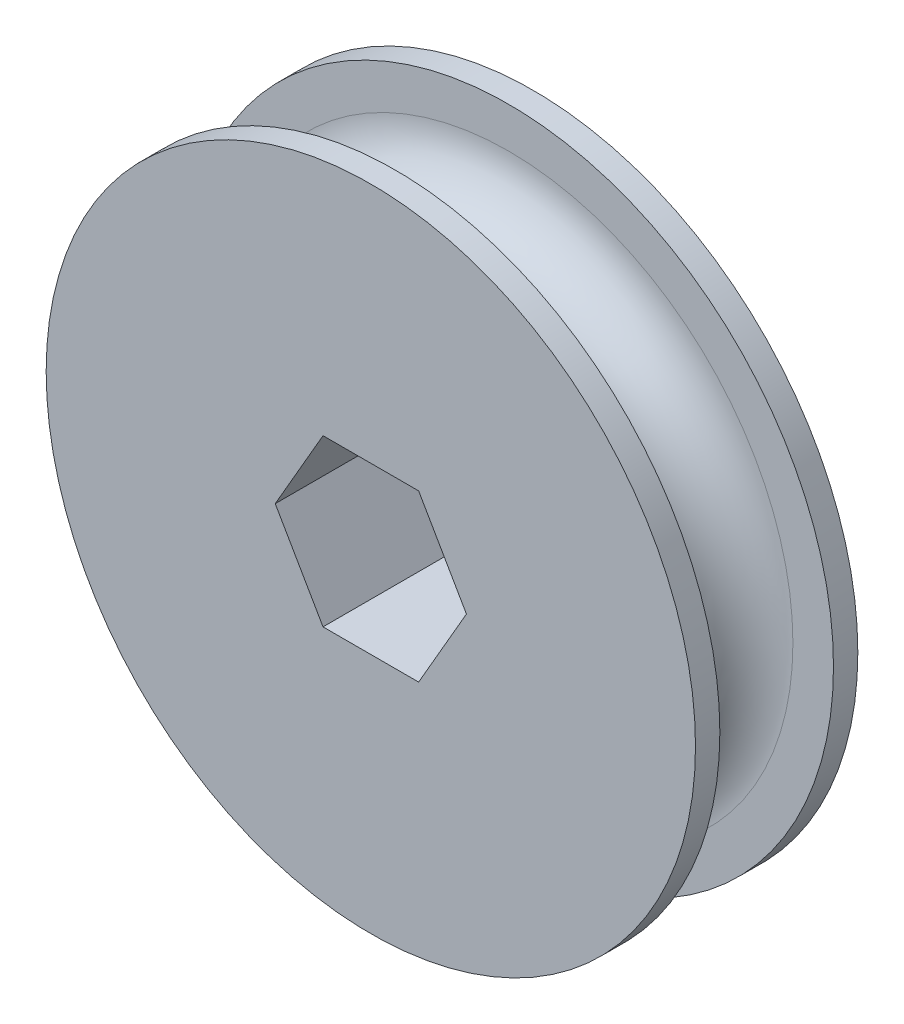
from build123d import *

# Parameters (mm, degrees)
SKETCH1_R           = 25.4
BOSS_EXTRUDE1_DEPTH = 6.35
CUT_EXTRUDE1_DEPTH  = 39.1


with BuildPart() as part:
    # Sketch1 → Boss-Extrude1 (new, symmetric)
    with BuildSketch(Plane.XY):
        Circle(SKETCH1_R)
    extrude(amount=BOSS_EXTRUDE1_DEPTH, both=True)

    # Sketch3 → Cut-Revolve1 (revolve, cut)
    with BuildSketch(Plane(origin=(0, 0, 0), x_dir=(1, 0, 0), z_dir=(0, 1, 0)), mode=Mode.PRIVATE) as cut_revolve1_sk:
        with BuildLine():
            Line((-25.4, 4.445), (-25.4, -4.445))
            Line((-25.4, -4.445), (-22.225, -4.445))
            ThreePointArc((-22.225, -4.445), (-17.78, 0), (-22.225, 4.445))
            Line((-22.225, 4.445), (-25.4, 4.445))
        make_face()
    revolve(cut_revolve1_sk.sketch.rotate(Axis((0, 0, 17.119668281), (0, 0, -1)), 180), axis=Axis((0, 0, 17.119668281), (0, 0, -1)), mode=Mode.SUBTRACT)

    # Sketch4 → Cut-Extrude1 (cut, through all)
    with BuildSketch(Plane(origin=(0, 0, -6.35), x_dir=(-1, 0, 0), z_dir=(0, 0, -1))):
        Polygon((7.478995387, 0), (3.739497694, 6.477), (-3.739497694, 6.477), (-7.478995387, 0), (-3.739497694, -6.477), (3.739497694, -6.477), align=None)
    extrude(amount=-CUT_EXTRUDE1_DEPTH, mode=Mode.SUBTRACT)


solid = part.part
